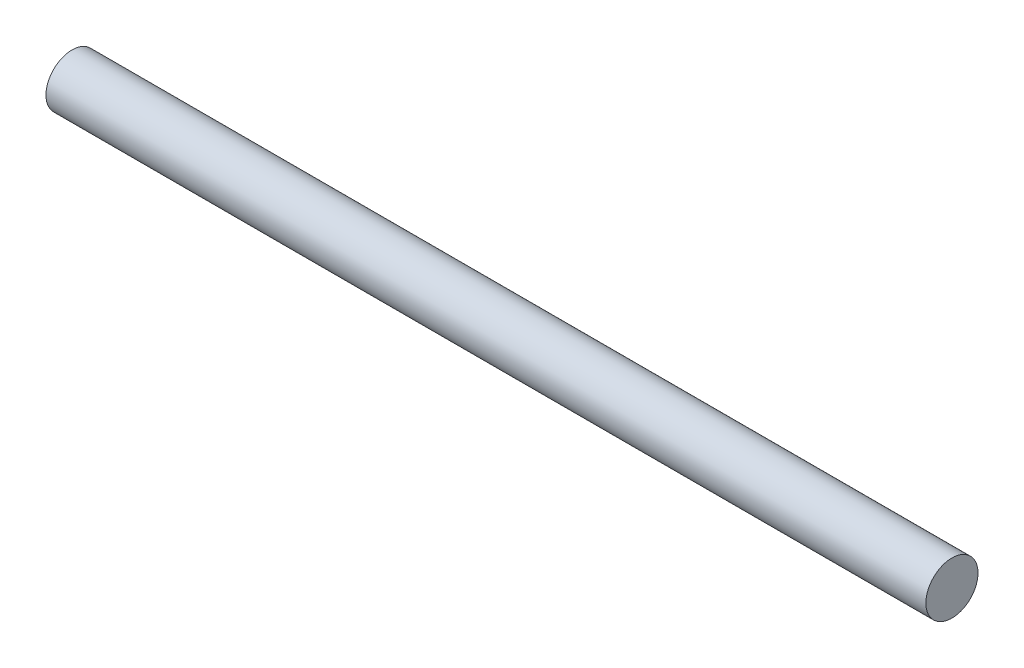
from build123d import *

# Parameters (mm, degrees)
SKETCH1_R           = 4
BOSS_EXTRUDE1_DEPTH = 120
SKETCH2_R           = 4
BOSS_EXTRUDE2_DEPTH = 15


with BuildPart() as part:
    # Sketch1 → Boss-Extrude1 (new body)
    with BuildSketch(Plane(origin=(0, 0, 0), x_dir=(0, 0, -1), z_dir=(1, 0, 0))):
        Circle(SKETCH1_R)
    extrude(amount=BOSS_EXTRUDE1_DEPTH)

    # Sketch2 → Boss-Extrude2 (add)
    with BuildSketch(Plane(origin=(120, 0, 0), x_dir=(0, 0, -1), z_dir=(1, 0, 0))):
        Circle(SKETCH2_R)
    extrude(amount=BOSS_EXTRUDE2_DEPTH)


solid = part.part
